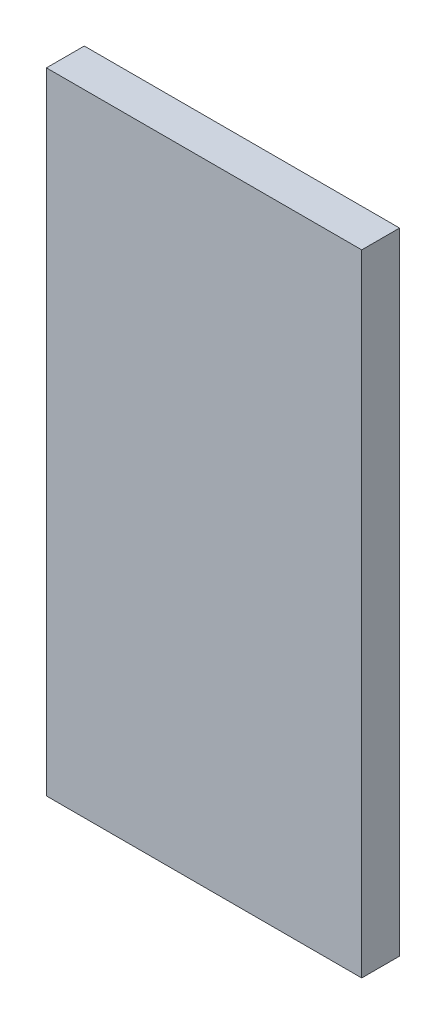
from build123d import *

# Parameters (mm, degrees)
ESBO_O1_W                = 15
ESBO_O1_H                = 30
RESSALTO_EXTRUS_O1_DEPTH = 1.8


with BuildPart() as part:
    # Esboço1 → Ressalto-extrusão1 (new body)
    with BuildSketch(Plane.XY):
        with Locations((93.86046672, 34.730944817)):
            Rectangle(ESBO_O1_W, ESBO_O1_H)
    extrude(amount=RESSALTO_EXTRUS_O1_DEPTH)


solid = part.part
